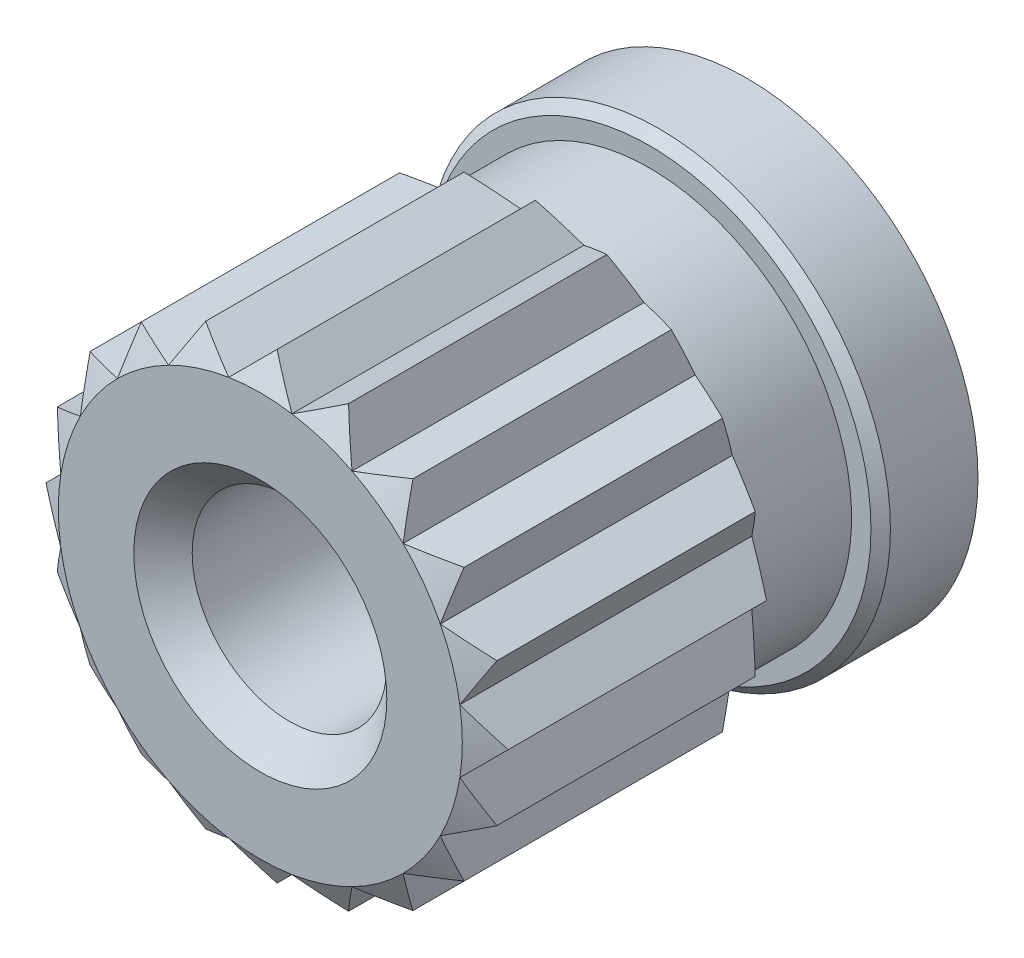
from build123d import *

# Parameters (mm, degrees)
BOSS_EXTRUDE1_DEPTH     = 1.5
SKETCH2_OUTSIDE_W       = 18.614
SKETCH2_OUTSIDE_H       = 18.614
SKETCH2_OUTSIDE_R       = 2.075826116
CUT_EXTRUDE1_DEPTH      = 3
CUT_EXTRUDE1_DRAFT      = -60
MIRROR1_COPY_1_SKETCH_W = 18.614
MIRROR1_COPY_1_SKETCH_H = 18.614
MIRROR1_COPY_1_SKETCH_R = 2.075826116
MIRROR1_COPY_1_DEPTH    = 3
MIRROR1_COPY_1_DRAFT    = -60
SKETCH3_R               = 2.375
BOSS_EXTRUDE2_DEPTH     = 2
CUT_EXTRUDE3_START      = -1
SKETCH5_OUTSIDE_W       = 8.424
SKETCH5_OUTSIDE_H       = 8.424
SKETCH5_OUTSIDE_R       = 2.075826116
CUT_EXTRUDE3_DEPTH      = 1
CHAMFER1_SIZE           = 0.1
SKETCH6_R               = 1
CUT_EXTRUDE4_DEPTH      = 4
CHAMFER2_SIZE           = 0.3


with BuildPart() as part:
    # Sketch1 → Boss-Extrude1 (new, symmetric)
    with BuildSketch(Plane.XY):
        Polygon((-0.324730748, 2.050269252), (0, 2.375), (0.324730748, 2.050269252), (0.733915362, 2.258759226), (0.942405336, 1.849574613), (1.395989974, 1.921415362), (1.467830723, 1.467830723), (1.921415362, 1.395989974), (1.849574613, 0.942405336), (2.258759226, 0.733915362), (2.050269252, 0.324730748), (2.375, 0), (2.050269252, -0.324730748), (2.258759226, -0.733915362), (1.849574613, -0.942405336), (1.921415362, -1.395989974), (1.467830723, -1.467830723), (1.395989974, -1.921415362), (0.942405336, -1.849574613), (0.733915362, -2.258759226), (0.324730748, -2.050269252), (0, -2.375), (-0.324730748, -2.050269252), (-0.733915362, -2.258759226), (-0.942405336, -1.849574613), (-1.395989974, -1.921415362), (-1.467830723, -1.467830723), (-1.921415362, -1.395989974), (-1.849574613, -0.942405336), (-2.258759226, -0.733915362), (-2.050269252, -0.324730748), (-2.375, 0), (-2.050269252, 0.324730748), (-2.258759226, 0.733915362), (-1.849574613, 0.942405336), (-1.921415362, 1.395989974), (-1.467830723, 1.467830723), (-1.395989974, 1.921415362), (-0.942405336, 1.849574613), (-0.733915362, 2.258759226), align=None)
    extrude(amount=BOSS_EXTRUDE1_DEPTH, both=True)


with BuildPart() as cut_extrude1_tool:
    # Sketch2 outside → Cut-Extrude1 (with draft: the straight prism first)
    with BuildSketch(Plane.XY.offset(1.5)):
        Rectangle(SKETCH2_OUTSIDE_W, SKETCH2_OUTSIDE_H)
        Circle(SKETCH2_OUTSIDE_R, mode=Mode.SUBTRACT)
    extrude(amount=-CUT_EXTRUDE1_DEPTH)
    # Cut-Extrude1: the draft: its side faces are tilted about the plane it starts from
    cut_extrude1_sides = [cut_extrude1_tool.faces().sort_by_distance(p)[0] for p in [
        (0, -9.307, 0),
        (9.307, 0, 0),
        (0, 9.307, 0),
        (-9.307, 0, 0),
        (-2.075826116, 0, 0),
    ]]
    draft(cut_extrude1_sides, Plane.XY.offset(1.5), CUT_EXTRUDE1_DRAFT)


with BuildPart() as part_1:
    add(part.part)

    # Cut-Extrude1: cut by cut_extrude1_tool
    add(cut_extrude1_tool.part, mode=Mode.SUBTRACT)


with BuildPart() as mirror1_copy_1_tool:
    # Mirror1 copy 1 sketch → Mirror1 copy 1 (with draft: the straight prism first)
    with BuildSketch(Plane(origin=(0, 0, -1.5), x_dir=(1, 0, 0), z_dir=(0, 0, -1))):
        Rectangle(MIRROR1_COPY_1_SKETCH_W, MIRROR1_COPY_1_SKETCH_H)
        Circle(MIRROR1_COPY_1_SKETCH_R, mode=Mode.SUBTRACT)
    extrude(amount=-MIRROR1_COPY_1_DEPTH)
    # Mirror1 copy 1: the draft: its side faces are tilted about the plane it starts from
    mirror1_copy_1_sides = [mirror1_copy_1_tool.faces().sort_by_distance(p)[0] for p in [
        (0, -9.307, 0),
        (9.307, 0, 0),
        (0, 9.307, 0),
        (-9.307, 0, 0),
        (-2.075826116, 0, 0),
    ]]
    draft(mirror1_copy_1_sides, Plane(origin=(0, 0, -1.5), x_dir=(1, 0, 0), z_dir=(0, 0, -1)), MIRROR1_COPY_1_DRAFT)


with BuildPart() as part_2:
    add(part_1.part)

    # Mirror1 copy 1: cut by mirror1_copy_1_tool
    add(mirror1_copy_1_tool.part, mode=Mode.SUBTRACT)

    # Sketch3 → Boss-Extrude2 (add)
    with BuildSketch(Plane(origin=(0, 0, -1.5), x_dir=(-1, 0, 0), z_dir=(0, 0, -1))):
        Circle(SKETCH3_R)
    extrude(amount=BOSS_EXTRUDE2_DEPTH)

    # Sketch5 outside → Cut-Extrude3 (cut)
    with BuildSketch(Plane(origin=(0, 0, -3.5), x_dir=(-1, 0, 0), z_dir=(0, 0, -1)).offset(CUT_EXTRUDE3_START)):
        Rectangle(SKETCH5_OUTSIDE_W, SKETCH5_OUTSIDE_H)
        Circle(SKETCH5_OUTSIDE_R, mode=Mode.SUBTRACT)
    extrude(amount=-CUT_EXTRUDE3_DEPTH, mode=Mode.SUBTRACT)

    # Chamfer1
    chamfer1_edges = [part_2.edges().sort_by_distance(p)[0] for p in [
        (2.375, 0, -2.5),
    ]]
    chamfer(chamfer1_edges, length=CHAMFER1_SIZE)

    # Sketch6 → Cut-Extrude4 (cut)
    with BuildSketch(Plane.XY.offset(1.5)):
        Circle(SKETCH6_R)
    extrude(amount=-CUT_EXTRUDE4_DEPTH, mode=Mode.SUBTRACT)

    # Chamfer2
    chamfer2_edges = [part_2.edges().sort_by_distance(p)[0] for p in [
        (-1, 0, 1.5),
    ]]
    chamfer(chamfer2_edges, length=CHAMFER2_SIZE)


solid = part_2.part
